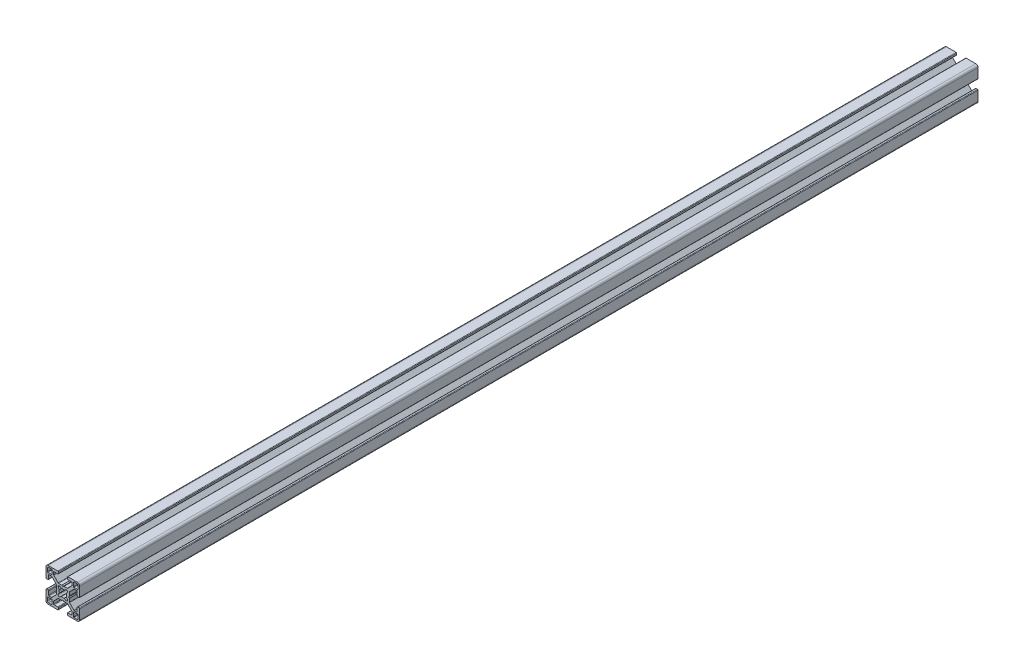
from build123d import *

# Parameters (mm, degrees)
BOSS_EXTRUDE1_DEPTH = 800.1


with BuildPart() as part:
    # Sketch1 → Boss-Extrude1 (new body)
    with BuildSketch(Plane(origin=(0, 0, -25), x_dir=(-1, 0, 0), z_dir=(0, 0, -1))):
        with BuildLine():
            Line((15, -13), (15, -4.508))
            ThreePointArc((15, -4.508), (14.851210245, -4.148789755), (14.492, -4))
            Line((14.492, -4), (13.251, -4))
            ThreePointArc((13.251, -4), (12.891789755, -4.148789755), (12.743, -4.508))
            Line((12.743, -4.508), (12.743, -7.742))
            ThreePointArc((12.743, -7.742), (12.594210245, -8.101210245), (12.235, -8.25))
            Line((12.235, -8.25), (10.26292049, -8.25))
            ThreePointArc((10.26292049, -8.25), (10.068517306, -8.211330803), (9.903710245, -8.101210245))
            Line((9.903710245, -8.101210245), (5.983289755, -4.180789755))
            ThreePointArc((5.983289755, -4.180789755), (5.873169197, -4.015982694), (5.8345, -3.82157951))
            Line((5.8345, -3.82157951), (5.8345, -0.949019985))
            Line((5.8345, -0.949019985), (5.325, 0))
            Line((5.325, 0), (5.8345, 0.949019985))
            Line((5.8345, 0.949019985), (5.8345, 3.820334926))
            ThreePointArc((5.8345, 3.820334926), (5.873169197, 4.01473811), (5.983289755, 4.179545171))
            Line((5.983289755, 4.179545171), (9.904954829, 8.101210245))
            ThreePointArc((9.904954829, 8.101210245), (10.06976189, 8.211330803), (10.264165074, 8.25))
            Line((10.264165074, 8.25), (12.235, 8.25))
            ThreePointArc((12.235, 8.25), (12.594210245, 8.101210245), (12.743, 7.742))
            Line((12.743, 7.742), (12.743, 4.508))
            ThreePointArc((12.743, 4.508), (12.891789755, 4.148789755), (13.251, 4))
            Line((13.251, 4), (14.492, 4))
            ThreePointArc((14.492, 4), (14.851210245, 4.148789755), (15, 4.508))
            Line((15, 4.508), (15, 13))
            ThreePointArc((15, 13), (14.414213562, 14.414213562), (13, 15))
            Line((13, 15), (4.508, 15))
            ThreePointArc((4.508, 15), (4.148789755, 14.851210245), (4, 14.492))
            Line((4, 14.492), (4, 13.251))
            ThreePointArc((4, 13.251), (4.148789755, 12.891789755), (4.508, 12.743))
            Line((4.508, 12.743), (7.742, 12.743))
            ThreePointArc((7.742, 12.743), (8.101210245, 12.594210245), (8.25, 12.235))
            Line((8.25, 12.235), (8.25, 10.26292049))
            ThreePointArc((8.25, 10.26292049), (8.211330803, 10.068517306), (8.101210245, 9.903710245))
            Line((8.101210245, 9.903710245), (4.180789755, 5.983289755))
            ThreePointArc((4.180789755, 5.983289755), (4.015982694, 5.873169197), (3.82157951, 5.8345))
            Line((3.82157951, 5.8345), (0.949019985, 5.8345))
            Line((0.949019985, 5.8345), (0, 5.325))
            Line((0, 5.325), (-0.949019985, 5.8345))
            Line((-0.949019985, 5.8345), (-3.820334926, 5.8345))
            ThreePointArc((-3.820334926, 5.8345), (-4.01473811, 5.873169197), (-4.179545171, 5.983289755))
            Line((-4.179545171, 5.983289755), (-8.101210245, 9.904954829))
            ThreePointArc((-8.101210245, 9.904954829), (-8.211330803, 10.06976189), (-8.25, 10.264165074))
            Line((-8.25, 10.264165074), (-8.25, 12.235))
            ThreePointArc((-8.25, 12.235), (-8.101210245, 12.594210245), (-7.742, 12.743))
            Line((-7.742, 12.743), (-4.508, 12.743))
            ThreePointArc((-4.508, 12.743), (-4.148789755, 12.891789755), (-4, 13.251))
            Line((-4, 13.251), (-4, 14.492))
            ThreePointArc((-4, 14.492), (-4.148789755, 14.851210245), (-4.508, 15))
            Line((-4.508, 15), (-13, 15))
            ThreePointArc((-13, 15), (-14.414213562, 14.414213562), (-15, 13))
            Line((-15, 13), (-15, 4.508))
            ThreePointArc((-15, 4.508), (-14.851210245, 4.148789755), (-14.492, 4))
            Line((-14.492, 4), (-13.251, 4))
            ThreePointArc((-13.251, 4), (-12.891789755, 4.148789755), (-12.743, 4.508))
            Line((-12.743, 4.508), (-12.743, 7.742))
            ThreePointArc((-12.743, 7.742), (-12.594210245, 8.101210245), (-12.235, 8.25))
            Line((-12.235, 8.25), (-10.26292049, 8.25))
            ThreePointArc((-10.26292049, 8.25), (-10.068517306, 8.211330803), (-9.903710245, 8.101210245))
            Line((-9.903710245, 8.101210245), (-5.983289755, 4.180789755))
            ThreePointArc((-5.983289755, 4.180789755), (-5.873169197, 4.015982694), (-5.8345, 3.82157951))
            Line((-5.8345, 3.82157951), (-5.8345, 0.949019985))
            Line((-5.8345, 0.949019985), (-5.325, 0))
            Line((-5.325, 0), (-5.8345, -0.949019985))
            Line((-5.8345, -0.949019985), (-5.8345, -3.820334926))
            ThreePointArc((-5.8345, -3.820334926), (-5.873169197, -4.01473811), (-5.983289755, -4.179545171))
            Line((-5.983289755, -4.179545171), (-9.904954829, -8.101210245))
            ThreePointArc((-9.904954829, -8.101210245), (-10.06976189, -8.211330803), (-10.264165074, -8.25))
            Line((-10.264165074, -8.25), (-12.235, -8.25))
            ThreePointArc((-12.235, -8.25), (-12.594210245, -8.101210245), (-12.743, -7.742))
            Line((-12.743, -7.742), (-12.743, -4.508))
            ThreePointArc((-12.743, -4.508), (-12.891789755, -4.148789755), (-13.251, -4))
            Line((-13.251, -4), (-14.492, -4))
            ThreePointArc((-14.492, -4), (-14.851210245, -4.148789755), (-15, -4.508))
            Line((-15, -4.508), (-15, -13))
            ThreePointArc((-15, -13), (-14.414213562, -14.414213562), (-13, -15))
            Line((-13, -15), (-4.508, -15))
            ThreePointArc((-4.508, -15), (-4.148789755, -14.851210245), (-4, -14.492))
            Line((-4, -14.492), (-4, -13.251))
            ThreePointArc((-4, -13.251), (-4.148789755, -12.891789755), (-4.508, -12.743))
            Line((-4.508, -12.743), (-7.742, -12.743))
            ThreePointArc((-7.742, -12.743), (-8.101210245, -12.594210245), (-8.25, -12.235))
            Line((-8.25, -12.235), (-8.25, -10.26292049))
            ThreePointArc((-8.25, -10.26292049), (-8.211330803, -10.068517306), (-8.101210245, -9.903710245))
            Line((-8.101210245, -9.903710245), (-4.180789755, -5.983289755))
            ThreePointArc((-4.180789755, -5.983289755), (-4.015982694, -5.873169197), (-3.82157951, -5.8345))
            Line((-3.82157951, -5.8345), (-0.949019985, -5.8345))
            Line((-0.949019985, -5.8345), (0, -5.325))
            Line((0, -5.325), (0.949019985, -5.8345))
            Line((0.949019985, -5.8345), (3.820334926, -5.8345))
            ThreePointArc((3.820334926, -5.8345), (4.01473811, -5.873169197), (4.179545171, -5.983289755))
            Line((4.179545171, -5.983289755), (8.101210245, -9.904954829))
            ThreePointArc((8.101210245, -9.904954829), (8.211330803, -10.06976189), (8.25, -10.264165074))
            Line((8.25, -10.264165074), (8.25, -12.235))
            ThreePointArc((8.25, -12.235), (8.101210245, -12.594210245), (7.742, -12.743))
            Line((7.742, -12.743), (4.508, -12.743))
            ThreePointArc((4.508, -12.743), (4.148789755, -12.891789755), (4, -13.251))
            Line((4, -13.251), (4, -14.492))
            ThreePointArc((4, -14.492), (4.148789755, -14.851210245), (4.508, -15))
            Line((4.508, -15), (13, -15))
            ThreePointArc((13, -15), (14.414213562, -14.414213562), (15, -13))
        make_face()
        with BuildLine():
            Line((13.7, -9.881), (13.7, -12.7))
            ThreePointArc((13.7, -12.7), (13.407106781, -13.407106781), (12.7, -13.7))
            Line((12.7, -13.7), (9.881, -13.7))
            ThreePointArc((9.881, -13.7), (9.611592316, -13.588407684), (9.5, -13.319))
            Line((9.5, -13.319), (9.5, -9.881))
            ThreePointArc((9.5, -9.881), (9.611592316, -9.611592316), (9.881, -9.5))
            Line((9.881, -9.5), (13.319, -9.5))
            ThreePointArc((13.319, -9.5), (13.588407684, -9.611592316), (13.7, -9.881))
        make_face(mode=Mode.SUBTRACT)
        with BuildLine():
            Line((13.7, 12.7), (13.7, 9.881))
            ThreePointArc((13.7, 9.881), (13.588407684, 9.611592316), (13.319, 9.5))
            Line((13.319, 9.5), (9.881, 9.5))
            ThreePointArc((9.881, 9.5), (9.611592316, 9.611592316), (9.5, 9.881))
            Line((9.5, 9.881), (9.5, 13.319))
            ThreePointArc((9.5, 13.319), (9.611592316, 13.588407684), (9.881, 13.7))
            Line((9.881, 13.7), (12.7, 13.7))
            ThreePointArc((12.7, 13.7), (13.407106781, 13.407106781), (13.7, 12.7))
        make_face(mode=Mode.SUBTRACT)
        with BuildLine():
            Line((3.054422686, -1.313821545), (4.010726841, -2.5139095))
            ThreePointArc((4.010726841, -2.5139095), (3.900018469, -3.900018469), (2.5139095, -4.010726841))
            Line((2.5139095, -4.010726841), (1.313821545, -3.054422686))
            ThreePointArc((1.313821545, -3.054422686), (0, -3.325), (-1.313821545, -3.054422686))
            Line((-1.313821545, -3.054422686), (-2.5139095, -4.010726841))
            ThreePointArc((-2.5139095, -4.010726841), (-3.900018469, -3.900018469), (-4.010726841, -2.5139095))
            Line((-4.010726841, -2.5139095), (-3.054422686, -1.313821545))
            ThreePointArc((-3.054422686, -1.313821545), (-3.325, 0), (-3.054422686, 1.313821545))
            Line((-3.054422686, 1.313821545), (-4.010726841, 2.5139095))
            ThreePointArc((-4.010726841, 2.5139095), (-3.900018469, 3.900018469), (-2.5139095, 4.010726841))
            Line((-2.5139095, 4.010726841), (-1.313821545, 3.054422686))
            ThreePointArc((-1.313821545, 3.054422686), (0, 3.325), (1.313821545, 3.054422686))
            Line((1.313821545, 3.054422686), (2.5139095, 4.010726841))
            ThreePointArc((2.5139095, 4.010726841), (3.900018469, 3.900018469), (4.010726841, 2.5139095))
            Line((4.010726841, 2.5139095), (3.054422686, 1.313821545))
            ThreePointArc((3.054422686, 1.313821545), (3.325, 0), (3.054422686, -1.313821545))
        make_face(mode=Mode.SUBTRACT)
        with BuildLine():
            Line((-9.5, 13.319), (-9.5, 9.881))
            ThreePointArc((-9.5, 9.881), (-9.611592316, 9.611592316), (-9.881, 9.5))
            Line((-9.881, 9.5), (-13.319, 9.5))
            ThreePointArc((-13.319, 9.5), (-13.588407684, 9.611592316), (-13.7, 9.881))
            Line((-13.7, 9.881), (-13.7, 12.7))
            ThreePointArc((-13.7, 12.7), (-13.407106781, 13.407106781), (-12.7, 13.7))
            Line((-12.7, 13.7), (-9.881, 13.7))
            ThreePointArc((-9.881, 13.7), (-9.611592316, 13.588407684), (-9.5, 13.319))
        make_face(mode=Mode.SUBTRACT)
        with BuildLine():
            Line((-9.5, -9.881), (-9.5, -13.319))
            ThreePointArc((-9.5, -13.319), (-9.611592316, -13.588407684), (-9.881, -13.7))
            Line((-9.881, -13.7), (-12.7, -13.7))
            ThreePointArc((-12.7, -13.7), (-13.407106781, -13.407106781), (-13.7, -12.7))
            Line((-13.7, -12.7), (-13.7, -9.881))
            ThreePointArc((-13.7, -9.881), (-13.588407684, -9.611592316), (-13.319, -9.5))
            Line((-13.319, -9.5), (-9.881, -9.5))
            ThreePointArc((-9.881, -9.5), (-9.611592316, -9.611592316), (-9.5, -9.881))
        make_face(mode=Mode.SUBTRACT)
    extrude(amount=-BOSS_EXTRUDE1_DEPTH)


solid = part.part
